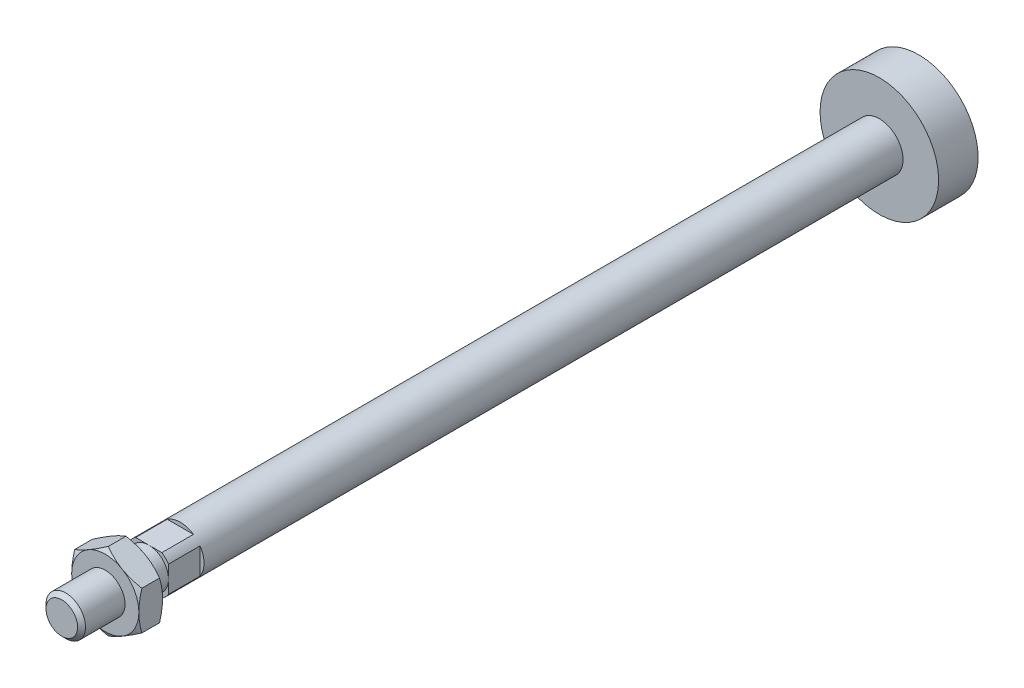
from build123d import *

# Parameters (mm, degrees)
EXTRUDE_1_DEPTH      = 6
SKETCH_5_3_OUTSIDE_W = 103.914
SKETCH_5_3_OUTSIDE_H = 103.914
SKETCH_5_3_OUTSIDE_R = 8.5
CUT_EXTRUDE_1_DEPTH  = 8
CUT_EXTRUDE_1_DRAFT  = -60
CUT_EXTRUDE_START    = -6
SKETCH_5_4_OUTSIDE_W = 103.914
SKETCH_5_4_OUTSIDE_H = 103.914
SKETCH_5_4_OUTSIDE_R = 8.5
CUT_EXTRUDE_2_DEPTH  = 8
CUT_EXTRUDE_2_DRAFT  = 60
CUT_EXTRUDE_START_2  = -8
CUT_EXTRUDE_3_DEPTH  = 8
CHAMFER_1_SIZE       = 1


with BuildPart() as part:
    # 草图4 → 旋转1 (revolve)
    with BuildSketch(Plane(origin=(0, 0, 0), x_dir=(0, 0, -1), z_dir=(1, 0, 0)), mode=Mode.PRIVATE) as revolve_1_sk:
        Polygon((206.9, 6), (206.9, 15), (216.9, 15), (216.9, 0), (0, 0), (0, 5), (22, 5), (22, 6), align=None)
    revolve(revolve_1_sk.sketch.rotate(Axis((0, 0, -216.9), (0, 0, 1)), 90), axis=Axis((0, 0, -216.9), (0, 0, 1)))

    # 草图6 → 切除-拉伸3 (cut)
    with BuildSketch(Plane.XY.offset(-22).offset(CUT_EXTRUDE_START_2)):
        with BuildLine():
            ThreePointArc((3.31662479, 5), (0, 6), (-3.31662479, 5))
            Line((-3.31662479, 5), (3.31662479, 5))
        make_face()
        with BuildLine():
            ThreePointArc((6, 0), (5.744562647, 1.732050808), (5, 3.31662479))
            Line((5, 3.31662479), (5, -3.31662479))
            ThreePointArc((5, -3.31662479), (5.744562647, -1.732050808), (6, 0))
        make_face()
        with BuildLine():
            Line((3.31662479, -5), (-3.31662479, -5))
            ThreePointArc((-3.31662479, -5), (0, -6), (3.31662479, -5))
        make_face()
        with BuildLine():
            Line((-5, -3.31662479), (-5, 3.31662479))
            ThreePointArc((-5, 3.31662479), (-6, 0), (-5, -3.31662479))
        make_face()
    extrude(amount=CUT_EXTRUDE_3_DEPTH, mode=Mode.SUBTRACT)

    # 倒角1
    chamfer_1_edges = [part.edges().sort_by_distance(p)[0] for p in [
        (5, 0, 0),
    ]]
    chamfer(chamfer_1_edges, length=CHAMFER_1_SIZE)


with BuildPart() as body_2:
    # 草图5 → 凸台-拉伸1 (new body)
    with BuildSketch(Plane.XY.offset(-11)):
        Polygon((0, 9.814954576), (-8.5, 4.907477288), (-8.5, -4.907477288), (0, -9.814954576), (8.5, -4.907477288), (8.5, 4.907477288), align=None)
    extrude(amount=-EXTRUDE_1_DEPTH)


with BuildPart() as cut_extrude_1_tool:
    # 草图5<3> outside → 切除-拉伸1 (with draft: the straight prism first)
    with BuildSketch(Plane.XY.offset(-11)):
        Rectangle(SKETCH_5_3_OUTSIDE_W, SKETCH_5_3_OUTSIDE_H)
        Circle(SKETCH_5_3_OUTSIDE_R, mode=Mode.SUBTRACT)
    extrude(amount=-CUT_EXTRUDE_1_DEPTH)
    # 切除-拉伸1: the draft: its side faces are tilted about the plane it starts from
    cut_extrude_1_sides = [cut_extrude_1_tool.faces().sort_by_distance(p)[0] for p in [
        (0, -51.957, -15),
        (51.957, 0, -15),
        (0, 51.957, -15),
        (-51.957, 0, -15),
        (-8.5, 0, -15),
    ]]
    draft(cut_extrude_1_sides, Plane.XY.offset(-11), CUT_EXTRUDE_1_DRAFT)


with BuildPart() as body_2_1:
    add(body_2.part)

    # 切除-拉伸1: cut by cut_extrude_1_tool
    add(cut_extrude_1_tool.part, mode=Mode.SUBTRACT)


with BuildPart() as cut_extrude_2_tool:
    # 草图5<4> outside → 切除-拉伸2 (with draft: the straight prism first)
    with BuildSketch(Plane.XY.offset(-11).offset(CUT_EXTRUDE_START)):
        Rectangle(SKETCH_5_4_OUTSIDE_W, SKETCH_5_4_OUTSIDE_H)
        Circle(SKETCH_5_4_OUTSIDE_R, mode=Mode.SUBTRACT)
    extrude(amount=CUT_EXTRUDE_2_DEPTH)
    # 切除-拉伸2: the draft: its side faces are tilted about the plane it starts from
    cut_extrude_2_sides = [cut_extrude_2_tool.faces().sort_by_distance(p)[0] for p in [
        (0, -51.957, -13),
        (51.957, 0, -13),
        (0, 51.957, -13),
        (-51.957, 0, -13),
        (-8.5, 0, -13),
    ]]
    draft(cut_extrude_2_sides, Plane.XY.offset(-11).offset(CUT_EXTRUDE_START), CUT_EXTRUDE_2_DRAFT)


with BuildPart() as body_2_2:
    add(body_2_1.part)

    # 切除-拉伸2: cut by cut_extrude_2_tool
    add(cut_extrude_2_tool.part, mode=Mode.SUBTRACT)

    # Combine 1: union part
    add(part.part)


solid = body_2_2.part
